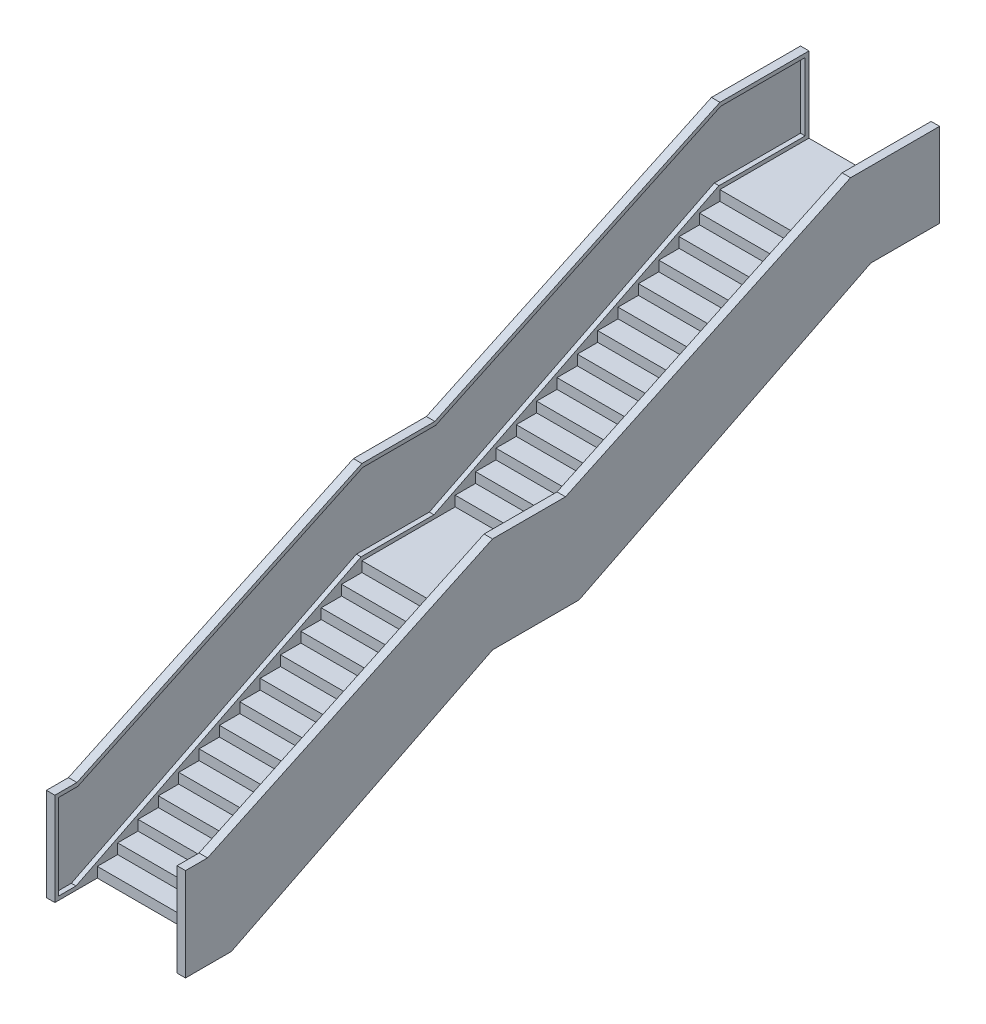
from build123d import *

# Parameters (mm, degrees)
BOSS_EXTRUDE1_DEPTH     = 1828.8
BOSS_EXTRUDE4_DEPTH     = 127
BOSS_EXTRUDE15_DEPTH    = 127
CUT_EXTRUDE2_DEPTH      = 7101.486050415
CUT_EXTRUDE2_DEPTH_BACK = 7101.486050415
SHELL1_T                = -2.54
SKETCH11_W              = 1828.8
SKETCH11_H              = 127
BOSS_EXTRUDE16_DEPTH    = 1028.7
SHELL2_T                = -57.15
SHELL3_T                = -57.15
BOSS_EXTRUDE20_DEPTH    = 127
BOSS_EXTRUDE21_DEPTH    = 127
BOSS_EXTRUDE22_DEPTH    = 57.15
BOSS_EXTRUDE22_2_DEPTH  = 57.15


with BuildPart() as part:
    # Sketch1 → Boss-Extrude1 (new body)
    with BuildSketch(Plane(origin=(0, 0, 0), x_dir=(0, 0, -1), z_dir=(1, 0, 0))):
        Polygon((4267.2, -2133.6), (4267.2, 0), (4267.2, 2133.6), (3962.4, 2133.6), (3962.4, 1981.2), (3657.6, 1981.2), (3657.6, 1828.8), (3352.8, 1828.8), (3352.8, 1676.4), (3048, 1676.4), (3048, 1524), (2743.2, 1524), (2743.2, 1371.6), (2438.4, 1371.6), (2438.4, 1219.2), (2133.6, 1219.2), (2133.6, 1066.8), (1828.8, 1066.8), (1828.8, 914.4), (1524, 914.4), (1524, 762), (1219.2, 762), (1219.2, 609.6), (914.4, 609.6), (914.4, 457.2), (609.6, 457.2), (609.6, 304.8), (304.8, 304.8), (304.8, 152.4), (0, 152.4), (0, 0), (-1397, 0), (-1397, -152.4), (-1701.8, -152.4), (-1701.8, -304.8), (-2006.6, -304.8), (-2006.6, -457.2), (-2311.4, -457.2), (-2311.4, -609.6), (-2616.2, -609.6), (-2616.2, -762), (-2921, -762), (-2921, -914.4), (-3225.8, -914.4), (-3225.8, -1066.8), (-3530.6, -1066.8), (-3530.6, -1219.2), (-3835.4, -1219.2), (-3835.4, -1371.6), (-4140.2, -1371.6), (-4140.2, -1524), (-4445, -1524), (-4445, -1676.4), (-4749.8, -1676.4), (-4749.8, -1828.8), (-5054.6, -1828.8), (-5054.6, -1981.2), (-5359.4, -1981.2), (-5359.4, -2133.6), align=None)
    extrude(amount=BOSS_EXTRUDE1_DEPTH)

    # Sketch10 → Cut-Extrude2 (cut, two sides: drawn at the far end of the back side and taken through both)
    with BuildSketch(Plane.ZY.offset(-CUT_EXTRUDE2_DEPTH_BACK)):
        Polygon((-4267.2, 2006.6), (-4267.2, -2133.6), (5308.6, -2133.6), (1397, -177.8), (101.6, -177.8), align=None)
    extrude(amount=CUT_EXTRUDE2_DEPTH + CUT_EXTRUDE2_DEPTH_BACK, mode=Mode.SUBTRACT)

    # Shell1
    shell1_openings = [part.faces().sort_by_distance(p)[0] for p in [
        (914.4, 914.4, -2082.8),
        (914.4, -177.8, 749.3),
        (914.4, -1155.7, 3352.8),
    ]]
    offset(amount=SHELL1_T, openings=shell1_openings, kind=Kind.INTERSECTION)

    # Sketch11 → Boss-Extrude16 (add)
    with BuildSketch(Plane(origin=(0, 0, -4267.2), x_dir=(-1, 0, 0), z_dir=(0, 0, -1))):
        with Locations((-914.4, 2070.1)):
            Rectangle(SKETCH11_W, SKETCH11_H)
    extrude(amount=BOSS_EXTRUDE16_DEPTH)


with BuildPart() as body_2:
    # Sketch3 → Boss-Extrude4 (new body)
    with BuildSketch(Plane(origin=(1828.8, 0, 0), x_dir=(0, 0, -1), z_dir=(1, 0, 0))):
        Polygon((-5994.4, -741.185974285), (-5664.2, -741.185974285), (-1397, 1261.4887112), (-304.8, 1261.4887112), (3963.755826751, 3264.799710876), (5297.255826751, 3264.799710876), (5297.255826751, 2133.6), (4267.2, 2133.6), (3962.4, 2133.6), (-304.8, 0), (-1397, 0), (-5664.2, -2133.6), (-5994.4, -2133.6), align=None)
    extrude(amount=BOSS_EXTRUDE4_DEPTH)

    # Shell2
    shell2_openings = [body_2.faces().sort_by_distance(p)[0] for p in [
        (1828.8, 730.093420749, 560.935464683),
    ]]
    offset(amount=SHELL2_T, openings=shell2_openings, kind=Kind.INTERSECTION)

    # Sketch17 → Boss-Extrude20 (add)
    with BuildSketch(Plane(origin=(1955.8, 0, 0), x_dir=(0, 0, -1), z_dir=(1, 0, 0))):
        Polygon((5295.9, 2133.6), (5295.9, 2006.6), (4267.2, 2006.6), (-101.6, -177.8), (-1397, -177.8), (-5308.6, -2133.6), (-5664.2, -2133.6), (-1397, 0), (-304.8, 0), (3962.4, 2133.6), align=None)
    extrude(amount=-BOSS_EXTRUDE20_DEPTH)


with BuildPart() as body_3:
    # Sketch4 → Boss-Extrude15 (new body)
    with BuildSketch(Plane.ZY):
        Polygon((-3962.4, 2133.6), (304.8, 0), (1397, 0), (5664.2, -2133.6), (5994.4, -2133.6), (5994.4, -741.185974285), (5664.2, -741.185974285), (1397, 1261.4887112), (304.8, 1261.4887112), (-3963.755826751, 3264.799710876), (-5297.255826751, 3264.799710876), (-5297.255826751, 2133.6), align=None)
    extrude(amount=BOSS_EXTRUDE15_DEPTH)

    # Shell3
    shell3_openings = [body_3.faces().sort_by_distance(p)[0] for p in [
        (0, 730.093420749, 560.935464683),
    ]]
    offset(amount=SHELL3_T, openings=shell3_openings, kind=Kind.INTERSECTION)

    # Sketch20 → Boss-Extrude21 (add)
    with BuildSketch(Plane.ZY.offset(127)):
        Polygon((-5297.255826751, 2133.6), (-3962.4, 2133.6), (304.8, 0), (1397, 0), (5664.2, -2133.6), (5308.6, -2133.6), (1397, -177.8), (101.6, -177.8), (-4267.2, 2006.6), (-5295.9, 2006.6), align=None)
    extrude(amount=-BOSS_EXTRUDE21_DEPTH)


with BuildPart() as body_4:
    # Sketch8 → Boss-Extrude22 (new body)
    with BuildSketch(Plane.ZY.offset(-1898.65)):
        Polygon((5715, -1949.45), (1398.494376234, 208.802811883), (1400.7662213, 213.346502013), (5717.271845065, -1944.90630987), align=None)
    extrude(amount=BOSS_EXTRUDE22_DEPTH)


with BuildPart() as body_5:
    # Sketch8 → Boss-Extrude22 2 (new body)
    with BuildSketch(Plane.ZY.offset(-1898.65)):
        Polygon((265.913370509, 314.510102927), (-3937, 2415.966788181), (-3934.728154935, 2420.510478311), (268.185215574, 319.053793057), align=None)
    extrude(amount=BOSS_EXTRUDE22_2_DEPTH)


solid = Compound([part.part, body_2.part, body_3.part, body_4.part, body_5.part])
